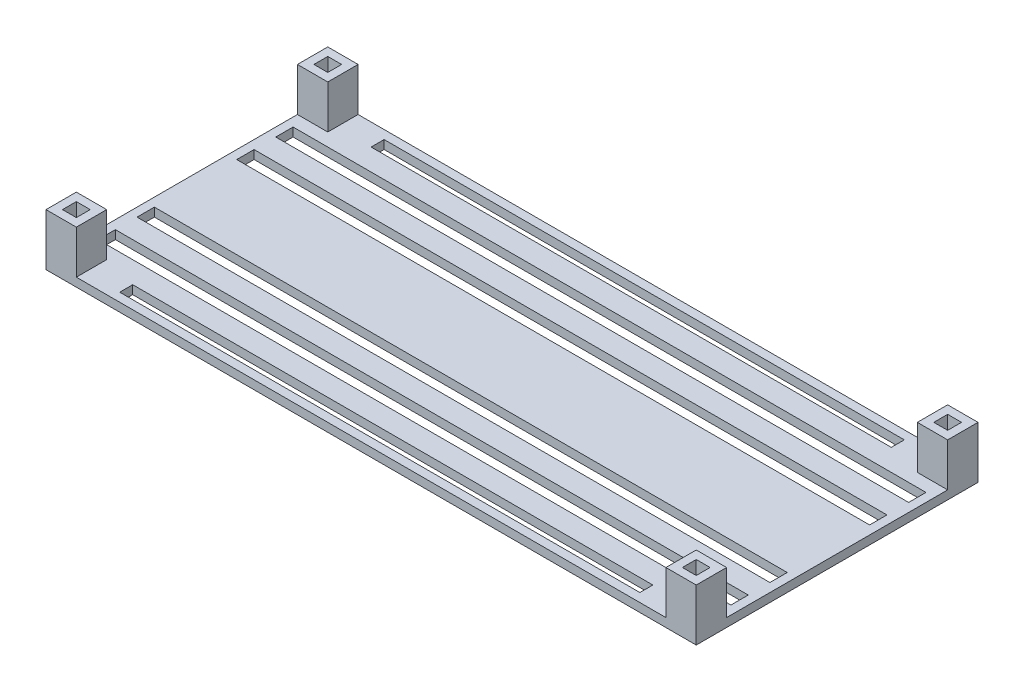
from build123d import *

# Parameters (mm, degrees)
SKETCH1_W               = 150
SKETCH1_H               = 65
BOSS_EXTRUDE1_DEPTH     = 2
BOSS_EXTRUDE2_START     = 2
SKETCH2_W               = 3
SKETCH2_H               = 3
BOSS_EXTRUDE2_DEPTH     = 50
CUT_EXTRUDE2_DEPTH      = 96.818839484
CUT_EXTRUDE2_DEPTH_BACK = 96.818839484
SKETCH4_W               = 120
SKETCH4_H               = 3
SKETCH4_W_2             = 146
SKETCH4_H_2             = 4
SKETCH5_W               = 7
SKETCH5_H               = 7
SKETCH5_W_2             = 3.2
SKETCH5_H_2             = 3.2
BOSS_EXTRUDE3_DEPTH     = 50
SKETCH2_3_W             = 3
SKETCH2_3_H             = 3
CUT_EXTRUDE3_DEPTH      = 52
CUT_EXTRUDE4_DEPTH      = 97.877499968
CUT_EXTRUDE4_DEPTH_BACK = 97.877499968
SKETCH6_W               = 182.778356439
SKETCH6_H               = 52.909524232


with BuildPart() as part:
    # Sketch1 → Boss-Extrude1 (new body)
    with BuildSketch(Plane(origin=(0, 0, 0), x_dir=(1, 0, 0), z_dir=(0, 1, 0))):
        Rectangle(SKETCH1_W, SKETCH1_H)
    extrude(amount=BOSS_EXTRUDE1_DEPTH)

    # Sketch2 → Boss-Extrude2 (add)
    with BuildSketch(Plane(origin=(0, 0, 0), x_dir=(1, 0, 0), z_dir=(0, 1, 0)).offset(BOSS_EXTRUDE2_START)):
        with Locations((71.5, 29)):
            Rectangle(SKETCH2_W, SKETCH2_H)
        with Locations((-71.5, 29)):
            Rectangle(SKETCH2_W, SKETCH2_H)
        with Locations((-71.5, -29)):
            Rectangle(SKETCH2_W, SKETCH2_H)
        with Locations((71.5, -29)):
            Rectangle(SKETCH2_W, SKETCH2_H)
    extrude(amount=BOSS_EXTRUDE2_DEPTH)

    # Sketch4 → Cut-Extrude2 (cut, two sides: drawn at the far end of the back side and taken through both)
    with BuildSketch(Plane(origin=(0, 2, 0), x_dir=(1, 0, 0), z_dir=(0, 1, 0)).offset(-CUT_EXTRUDE2_DEPTH_BACK)):
        with Locations((0, 29)):
            Rectangle(SKETCH4_W, SKETCH4_H)
        with Locations((0, 20.5)):
            Rectangle(SKETCH4_W_2, SKETCH4_H_2)
        with Locations((0, 11.5)):
            Rectangle(SKETCH4_W_2, SKETCH4_H_2)
        with Locations((0, -11.5)):
            Rectangle(SKETCH4_W_2, SKETCH4_H_2)
        with Locations((0, -20.5)):
            Rectangle(SKETCH4_W_2, SKETCH4_H_2)
        with Locations((0, -29)):
            Rectangle(SKETCH4_W, SKETCH4_H)
    extrude(amount=CUT_EXTRUDE2_DEPTH + CUT_EXTRUDE2_DEPTH_BACK, mode=Mode.SUBTRACT)

    # Sketch5 → Boss-Extrude3 (add)
    # profile 1 of 4: a face of its own
    with BuildSketch(Plane(origin=(0, 2, 0), x_dir=(1, 0, 0), z_dir=(0, 1, 0))):
        with Locations((71.5, 29)):
            Rectangle(SKETCH5_W, SKETCH5_H)
        with Locations((71.5, 29)):
            Rectangle(SKETCH5_W_2, SKETCH5_H_2, mode=Mode.SUBTRACT)
    # profile 2 of 4: a face of its own
    with BuildSketch(Plane(origin=(0, 2, 0), x_dir=(1, 0, 0), z_dir=(0, 1, 0))):
        with Locations((71.5, -29)):
            Rectangle(SKETCH5_W, SKETCH5_H)
        with Locations((71.5, -29)):
            Rectangle(SKETCH5_W_2, SKETCH5_H_2, mode=Mode.SUBTRACT)
    # profile 3 of 4: a face of its own
    with BuildSketch(Plane(origin=(0, 2, 0), x_dir=(1, 0, 0), z_dir=(0, 1, 0))):
        with Locations((-71.5, -29)):
            Rectangle(SKETCH5_W, SKETCH5_H)
        with Locations((-71.5, -29)):
            Rectangle(SKETCH5_W_2, SKETCH5_H_2, mode=Mode.SUBTRACT)
    # profile 4 of 4: a face of its own
    with BuildSketch(Plane(origin=(0, 2, 0), x_dir=(1, 0, 0), z_dir=(0, 1, 0))):
        with Locations((-71.5, 29)):
            Rectangle(SKETCH5_W, SKETCH5_H)
        with Locations((-71.5, 29)):
            Rectangle(SKETCH5_W_2, SKETCH5_H_2, mode=Mode.SUBTRACT)
    extrude(amount=BOSS_EXTRUDE3_DEPTH)

    # Sketch2<3> → Cut-Extrude3 (cut)
    with BuildSketch(Plane(origin=(0, 0, 0), x_dir=(1, 0, 0), z_dir=(0, 1, 0))):
        with Locations((71.5, 29)):
            Rectangle(SKETCH2_3_W, SKETCH2_3_H)
        with Locations((-71.5, 29)):
            Rectangle(SKETCH2_3_W, SKETCH2_3_H)
        with Locations((-71.5, -29)):
            Rectangle(SKETCH2_3_W, SKETCH2_3_H)
        with Locations((71.5, -29)):
            Rectangle(SKETCH2_3_W, SKETCH2_3_H)
    extrude(amount=CUT_EXTRUDE3_DEPTH, mode=Mode.SUBTRACT)

    # Sketch6 → Cut-Extrude4 (cut, two sides: drawn at the far end of the back side and taken through both)
    with BuildSketch(Plane.XY.offset(-CUT_EXTRUDE4_DEPTH_BACK)):
        with Locations((0.082930289, 38.454762116)):
            Rectangle(SKETCH6_W, SKETCH6_H)
    extrude(amount=CUT_EXTRUDE4_DEPTH + CUT_EXTRUDE4_DEPTH_BACK, mode=Mode.SUBTRACT)


solid = part.part
